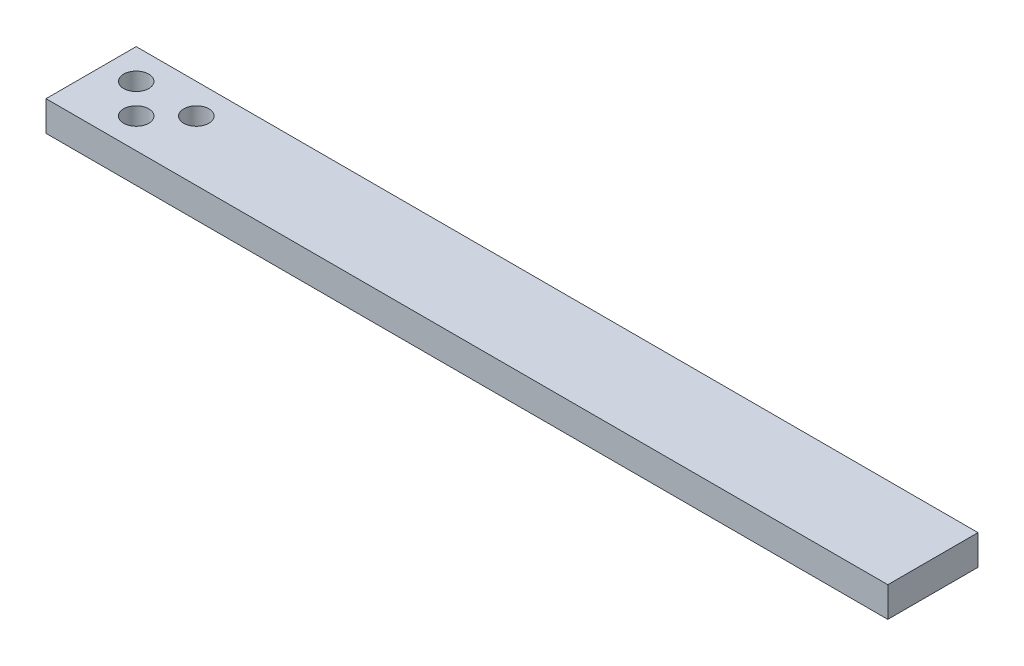
from build123d import *

# Parameters (mm, degrees)
SKETCH1_W                      = 177.8
SKETCH1_H                      = 19.05
BOSS_EXTRUDE1_DEPTH            = 6.35
F_4_0_209_DIAMETER_HOLE1_D     = 5.3086
F_4_0_209_DIAMETER_HOLE1_DEPTH = 10.668
F_4_0_209_DIAMETER_HOLE1_TIP   = 1.594864341


with BuildPart() as part:
    # Sketch1 → Boss-Extrude1 (new body)
    with BuildSketch(Plane(origin=(0, 0, 0), x_dir=(1, 0, 0), z_dir=(0, 1, 0))):
        with Locations((88.9, 9.525)):
            Rectangle(SKETCH1_W, SKETCH1_H)
    extrude(amount=BOSS_EXTRUDE1_DEPTH)

    # #4 (0.209) Diameter Hole1
    with Locations(Plane(origin=(6.35, 6.35, -12.7), x_dir=(0, 0, 1), z_dir=(0, 1, 0))):
        with Locations((0, 0), (0, 12.7), (6.35, 6.35)):
            Hole(F_4_0_209_DIAMETER_HOLE1_D / 2, depth=F_4_0_209_DIAMETER_HOLE1_DEPTH)
            with Locations((0, 0, -(F_4_0_209_DIAMETER_HOLE1_DEPTH + F_4_0_209_DIAMETER_HOLE1_TIP / 2))):  # 118° drill point
                Cone(0, F_4_0_209_DIAMETER_HOLE1_D / 2, F_4_0_209_DIAMETER_HOLE1_TIP, mode=Mode.SUBTRACT)


solid = part.part
